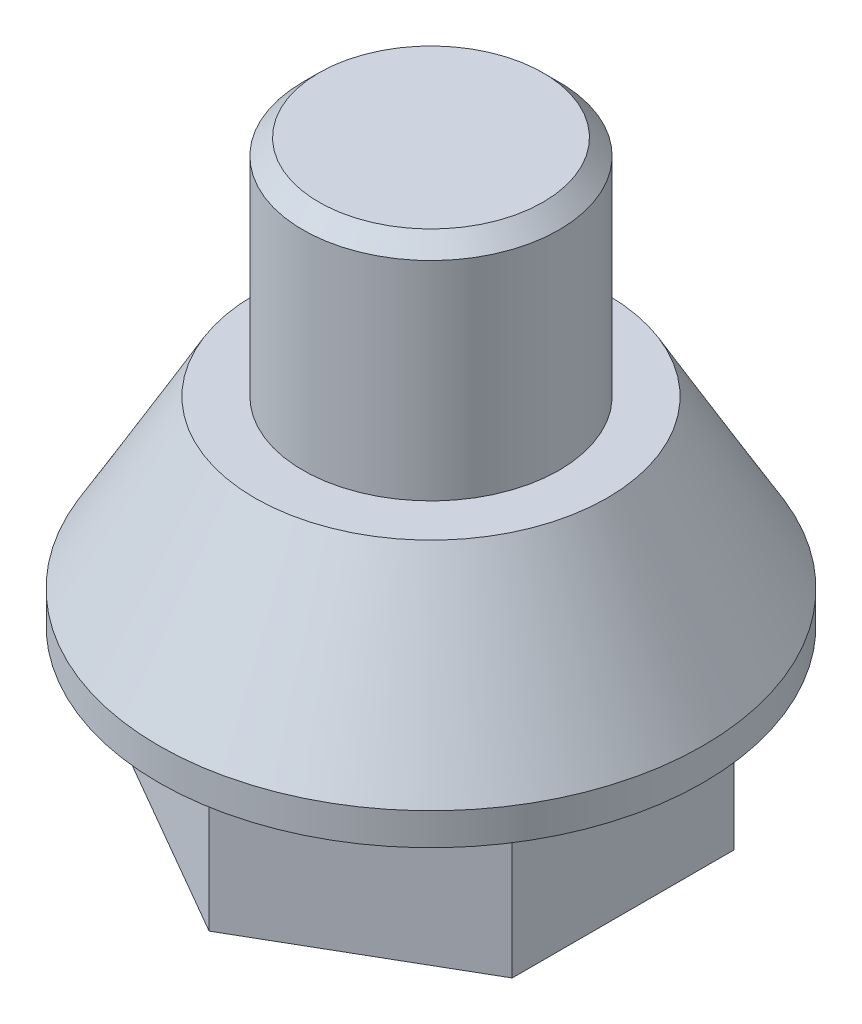
from build123d import *

# Parameters (mm, degrees)
BOSS_EXTRUDE1_DEPTH = 4.8
SKETCH2_R           = 8.5
BOSS_EXTRUDE2_DEPTH = 1
CHAMFER1_SIZE       = 0.5


with BuildPart() as part:
    # Sketch1 → Boss-Extrude1 (new body)
    with BuildSketch(Plane(origin=(0, 0, 0), x_dir=(1, 0, 0), z_dir=(0, 1, 0))):
        Polygon((0, 6.92820323), (6, 3.464101615), (6, -3.464101615), (0, -6.92820323), (-6, -3.464101615), (-6, 3.464101615), align=None)
    extrude(amount=BOSS_EXTRUDE1_DEPTH)

    # Sketch2 → Boss-Extrude2 (add)
    with BuildSketch(Plane(origin=(0, 4.8, 0), x_dir=(1, 0, 0), z_dir=(0, 1, 0))):
        with Locations(Location((0, 0, 0), (0, 0, 270))):
            Circle(SKETCH2_R)
    extrude(amount=BOSS_EXTRUDE2_DEPTH)

    # Sketch3 → Revolve1 (revolve)
    with BuildSketch(Plane.XY):
        Polygon((0, 5.8), (8.5, 5.8), (5.5, 10.996152423), (4, 10.996152423), (4, 17.996152423), (0, 17.996152423), align=None)
    revolve(axis=Axis((0, 5.8, 0), (0, 1, 0)))

    # Chamfer1
    chamfer1_edges = [part.edges().sort_by_distance(p)[0] for p in [
        (-4, 17.996152423, 0),
    ]]
    chamfer(chamfer1_edges, length=CHAMFER1_SIZE)


solid = part.part
